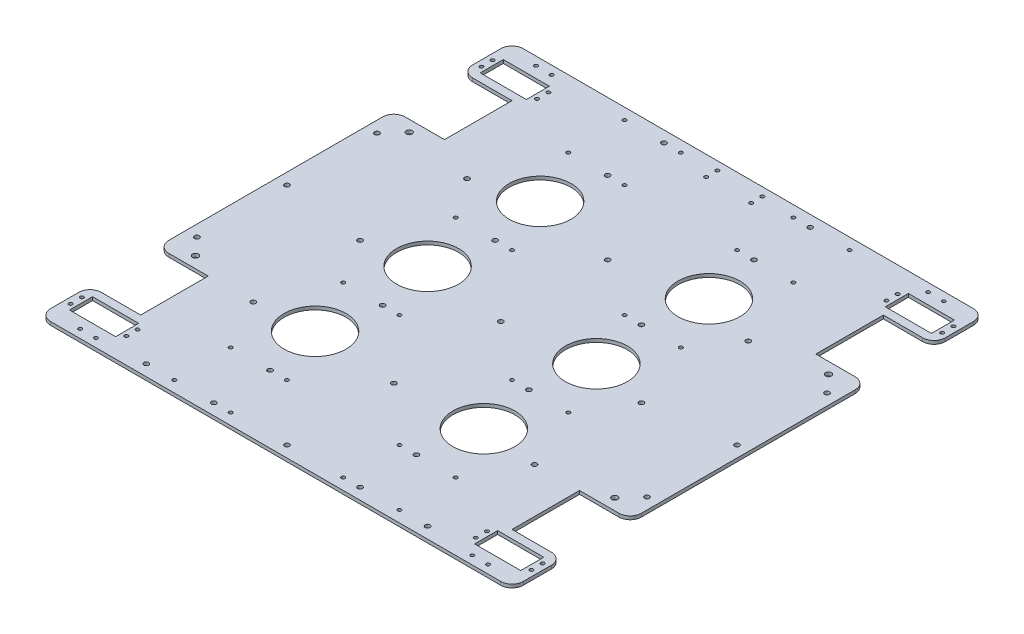
from build123d import *

# Parameters (mm, degrees)
SKETCH_2_W                                   = 420
SKETCH_2_H                                   = 420
EXTRUDE_1_DEPTH                              = 3
SKETCH_3_R                                   = 1.6
SKETCH_3_W                                   = 41
SKETCH_3_H                                   = 20.5
SKETCH_3_W_2                                 = 45
SKETCH_3_H_2                                 = 60
CUT_EXTRUDE_1_DEPTH                          = 298
MIRROR_2_AT_THE_SECOND_PLANE_COPY_1_SKET_R   = 1.6
MIRROR_2_AT_THE_SECOND_PLANE_COPY_1_SKET_W   = 41
MIRROR_2_AT_THE_SECOND_PLANE_COPY_1_SKET_H   = 20.5
MIRROR_2_AT_THE_SECOND_PLANE_COPY_1_SKET_W_2 = 45
MIRROR_2_AT_THE_SECOND_PLANE_COPY_1_SKET_H_2 = 60
MIRROR_2_AT_THE_SECOND_PLANE_COPY_1_DEPTH    = 298
SKETCH_7_R                                   = 2.65
CUT_EXTRUDE_5_DEPTH                          = 298
SKETCH_5_R                                   = 2.15
CUT_EXTRUDE_8_DEPTH                          = 298
PATTERN_LINEAR_4_COUNT                       = 5
PATTERN_LINEAR_4_PITCH                       = 50
PATTERN_LINEAR_4_COL_COUNT                   = 5
PATTERN_LINEAR_4_COL_PITCH                   = 50
SKETCH_6_R                                   = 2.15
CUT_EXTRUDE_9_DEPTH                          = 298
PATTERN_LINEAR_5_COUNT                       = 4
PATTERN_LINEAR_5_PITCH                       = 95
SKETCH_9_R                                   = 1.6
CUT_EXTRUDE_7_DEPTH                          = 298
PATTERN_LINEAR_3_COUNT                       = 9
PATTERN_LINEAR_3_PITCH                       = 50
SKETCH_10_R                                  = 27.5
CUT_EXTRUDE_10_DEPTH                         = 298
SKETCH_8_R                                   = 2.15
SKETCH_8_R_2                                 = 1.6
CUT_EXTRUDE_6_DEPTH                          = 298
FILLET_1_R                                   = 10
SKETCH_11_R                                  = 1.6
CUT_EXTRUDE_11_DEPTH                         = 5


with BuildPart() as part:
    # 草图2 → 凸台-拉伸1 (new body)
    with BuildSketch(Plane(origin=(0, 0, 0), x_dir=(1, 0, 0), z_dir=(0, 1, 0))):
        Rectangle(SKETCH_2_W, SKETCH_2_H)
    extrude(amount=EXTRUDE_1_DEPTH)

    # 草图3 → 切除-拉伸1 (cut, through all)
    with BuildSketch(Plane(origin=(0, 0, 0), x_dir=(1, 0, 0), z_dir=(0, 1, 0))):
        with Locations(Location((-204.75, 187.5, 0), (0, 0, 270))):
            Circle(SKETCH_3_R)
        with Locations(Location((-204.75, 177.5, 0), (0, 0, 270))):
            Circle(SKETCH_3_R)
        with Locations(Location((-155.25, 187.5, 0), (0, 0, 270))):
            Circle(SKETCH_3_R)
        with Locations(Location((-155.25, 177.5, 0), (0, 0, 270))):
            Circle(SKETCH_3_R)
        with Locations((-180, 182.5)):
            Rectangle(SKETCH_3_W, SKETCH_3_H)
        with Locations((-187.5, 135)):
            Rectangle(SKETCH_3_W_2, SKETCH_3_H_2)
    cut_extrude_1 = extrude(amount=CUT_EXTRUDE_1_DEPTH, mode=Mode.SUBTRACT)

    # 镜向2: 切除-拉伸1 across plane
    add(cut_extrude_1.mirror(Plane(origin=(0, 0, 0), x_dir=(0, 0, 1), z_dir=(1, 0, 0))), mode=Mode.SUBTRACT)

    # 镜向2 at the second plane: 切除-拉伸1 across plane
    add(cut_extrude_1.mirror(Plane.XY), mode=Mode.SUBTRACT)

    # 镜向2 at the second plane copy 1 sket → 镜向2 at the second plane copy 1 (cut, through all)
    with BuildSketch(Plane(origin=(0, 0, 0), x_dir=(-1, 0, 0), z_dir=(0, 1, 0))):
        with Locations(Location((-204.75, 187.5, 0), (0, 0, 270))):
            Circle(MIRROR_2_AT_THE_SECOND_PLANE_COPY_1_SKET_R)
        with Locations(Location((-204.75, 177.5, 0), (0, 0, 270))):
            Circle(MIRROR_2_AT_THE_SECOND_PLANE_COPY_1_SKET_R)
        with Locations(Location((-155.25, 187.5, 0), (0, 0, 270))):
            Circle(MIRROR_2_AT_THE_SECOND_PLANE_COPY_1_SKET_R)
        with Locations(Location((-155.25, 177.5, 0), (0, 0, 270))):
            Circle(MIRROR_2_AT_THE_SECOND_PLANE_COPY_1_SKET_R)
        with Locations((-180, 182.5)):
            Rectangle(MIRROR_2_AT_THE_SECOND_PLANE_COPY_1_SKET_W, MIRROR_2_AT_THE_SECOND_PLANE_COPY_1_SKET_H)
        with Locations((-187.5, 135)):
            Rectangle(MIRROR_2_AT_THE_SECOND_PLANE_COPY_1_SKET_W_2, MIRROR_2_AT_THE_SECOND_PLANE_COPY_1_SKET_H_2)
    extrude(amount=MIRROR_2_AT_THE_SECOND_PLANE_COPY_1_DEPTH, mode=Mode.SUBTRACT)

    # 草图7 → 切除-拉伸5 (cut, through all)
    with BuildSketch(Plane(origin=(0, 0, 0), x_dir=(1, 0, 0), z_dir=(0, 1, 0))):
        with Locations(Location((-186.25, 95, 0), (0, 0, 270))):
            Circle(SKETCH_7_R)
        with Locations(Location((-186.25, -95, 0), (0, 0, 270))):
            Circle(SKETCH_7_R)
        with Locations(Location((186.25, -95, 0), (0, 0, 270))):
            Circle(SKETCH_7_R)
        with Locations(Location((186.25, 95, 0), (0, 0, 270))):
            Circle(SKETCH_7_R)
    extrude(amount=CUT_EXTRUDE_5_DEPTH, mode=Mode.SUBTRACT)

    # 草图5 → 切除-拉伸8 (cut, through all)
    with BuildSketch(Plane(origin=(0, 0, 0), x_dir=(1, 0, 0), z_dir=(0, 1, 0))):
        with Locations(Location((-65, 0, 0), (0, 0, 270))):
            Circle(SKETCH_5_R)
        with Locations(Location((65, 0, 0), (0, 0, 270))):
            Circle(SKETCH_5_R)
    cut_extrude_8 = extrude(amount=CUT_EXTRUDE_8_DEPTH, mode=Mode.SUBTRACT)

    # 阵列(线性)4: 切除-拉伸8 ×5
    with Locations(*[(0, 0, i * PATTERN_LINEAR_4_PITCH) for i in range(1, PATTERN_LINEAR_4_COUNT)]):
        add(cut_extrude_8, mode=Mode.SUBTRACT)

    # 阵列(线性)4 col: 切除-拉伸8 ×5
    with Locations(*[(0, 0, -i * PATTERN_LINEAR_4_COL_PITCH) for i in range(1, PATTERN_LINEAR_4_COL_COUNT)]):
        add(cut_extrude_8, mode=Mode.SUBTRACT)

    # 草图6 → 切除-拉伸9 (cut, through all)
    with BuildSketch(Plane(origin=(0, 0, 0), x_dir=(1, 0, 0), z_dir=(0, 1, 0))):
        with Locations(Location((-125, -200, 0), (0, 0, 270))):
            Circle(SKETCH_6_R)
        with Locations(Location((125, -200, 0), (0, 0, 270))):
            Circle(SKETCH_6_R)
        with Locations(Location((0, -200, 0), (0, 0, 270))):
            Circle(SKETCH_6_R)
    cut_extrude_9 = extrude(amount=CUT_EXTRUDE_9_DEPTH, mode=Mode.SUBTRACT)

    # 阵列(线性)5: 切除-拉伸9 ×4
    with Locations(*[(0, 0, -i * PATTERN_LINEAR_5_PITCH) for i in range(1, PATTERN_LINEAR_5_COUNT)]):
        add(cut_extrude_9, mode=Mode.SUBTRACT)

    # 草图9 → 切除-拉伸7 (cut, through all)
    with BuildSketch(Plane(origin=(0, 0, 0), x_dir=(1, 0, 0), z_dir=(0, 1, 0))):
        with Locations(Location((-100, -200, 0), (0, 0, 270))):
            Circle(SKETCH_9_R)
        with Locations(Location((-50, -200, 0), (0, 0, 270))):
            Circle(SKETCH_9_R)
        with Locations(Location((50, -200, 0), (0, 0, 270))):
            Circle(SKETCH_9_R)
        with Locations(Location((100, -200, 0), (0, 0, 270))):
            Circle(SKETCH_9_R)
    cut_extrude_7 = extrude(amount=CUT_EXTRUDE_7_DEPTH, mode=Mode.SUBTRACT)

    # 阵列(线性)3: 切除-拉伸7 ×9
    with Locations(*[(0, 0, -i * PATTERN_LINEAR_3_PITCH) for i in range(1, PATTERN_LINEAR_3_COUNT)]):
        add(cut_extrude_7, mode=Mode.SUBTRACT)

    # 草图10 → 切除-拉伸10 (cut, through all)
    with BuildSketch(Plane(origin=(0, 0, 0), x_dir=(1, 0, 0), z_dir=(0, 1, 0))):
        with Locations(Location((-75, 100, 0), (0, 0, 270))):
            Circle(SKETCH_10_R)
        with Locations(Location((75, 100, 0), (0, 0, 270))):
            Circle(SKETCH_10_R)
        with Locations(Location((75, 0, 0), (0, 0, 270))):
            Circle(SKETCH_10_R)
        with Locations(Location((-75, 0, 0), (0, 0, 270))):
            Circle(SKETCH_10_R)
        with Locations(Location((-75, -100, 0), (0, 0, 270))):
            Circle(SKETCH_10_R)
        with Locations(Location((75, -100, 0), (0, 0, 270))):
            Circle(SKETCH_10_R)
    extrude(amount=CUT_EXTRUDE_10_DEPTH, mode=Mode.SUBTRACT)

    # 草图8 → 切除-拉伸6 (cut, through all)
    with BuildSketch(Plane(origin=(0, 0, 0), x_dir=(1, 0, 0), z_dir=(0, 1, 0))):
        with Locations(Location((-200, 80, 0), (0, 0, 270))):
            Circle(SKETCH_8_R)
        with Locations(Location((-200, -80, 0), (0, 0, 270))):
            Circle(SKETCH_8_R)
        with Locations(Location((-200, 0, 0), (0, 0, 270))):
            Circle(SKETCH_8_R)
        with Locations(Location((200, 0, 0), (0, 0, 270))):
            Circle(SKETCH_8_R)
        with Locations(Location((200, 80, 0), (0, 0, 270))):
            Circle(SKETCH_8_R)
        with Locations(Location((200, -80, 0), (0, 0, 270))):
            Circle(SKETCH_8_R)
        with Locations(Location((-167.25, 202.5, 0), (0, 0, 270))):
            Circle(SKETCH_8_R_2)
        with Locations(Location((-181.25, 202.5, 0), (0, 0, 270))):
            Circle(SKETCH_8_R_2)
        with Locations(Location((181.25, 202.5, 0), (0, 0, 270))):
            Circle(SKETCH_8_R_2)
        with Locations(Location((181.25, -202.5, 0), (0, 0, 270))):
            Circle(SKETCH_8_R_2)
        with Locations(Location((-181.25, -202.5, 0), (0, 0, 270))):
            Circle(SKETCH_8_R_2)
        with Locations(Location((167.25, 202.5, 0), (0, 0, 270))):
            Circle(SKETCH_8_R_2)
        with Locations(Location((-167.25, -202.5, 0), (0, 0, 270))):
            Circle(SKETCH_8_R_2)
        with Locations(Location((167.25, -202.5, 0), (0, 0, 270))):
            Circle(SKETCH_8_R_2)
    extrude(amount=CUT_EXTRUDE_6_DEPTH, mode=Mode.SUBTRACT)

    # 圆角1
    fillet_1_edges = [part.edges().sort_by_distance(p)[0] for p in [
        (210, 1.5, -105),
        (210, 1.5, -165),
        (210, 1.5, 165),
        (210, 1.5, 105),
        (-210, 1.5, -165),
        (-210, 1.5, -105),
        (-210, 1.5, 105),
        (-210, 1.5, 165),
        (-210, 1.5, -210),
        (210, 1.5, -210),
        (210, 1.5, 210),
        (-210, 1.5, 210),
    ]]
    fillet(fillet_1_edges, radius=FILLET_1_R)

    # 草图11 → 切除-拉伸11 (cut)
    with BuildSketch(Plane(origin=(0, 3, 0), x_dir=(1, 0, 0), z_dir=(0, 1, 0))):
        with Locations(Location((-20, 202.5, 0), (0, 0, 270))):
            Circle(SKETCH_11_R)
        with Locations(Location((20, 202.5, 0), (0, 0, 270))):
            Circle(SKETCH_11_R)
        with Locations(Location((-20, 192.5, 0), (0, 0, 270))):
            Circle(SKETCH_11_R)
        with Locations(Location((20, 192.5, 0), (0, 0, 270))):
            Circle(SKETCH_11_R)
    extrude(amount=-CUT_EXTRUDE_11_DEPTH, mode=Mode.SUBTRACT)


solid = part.part
